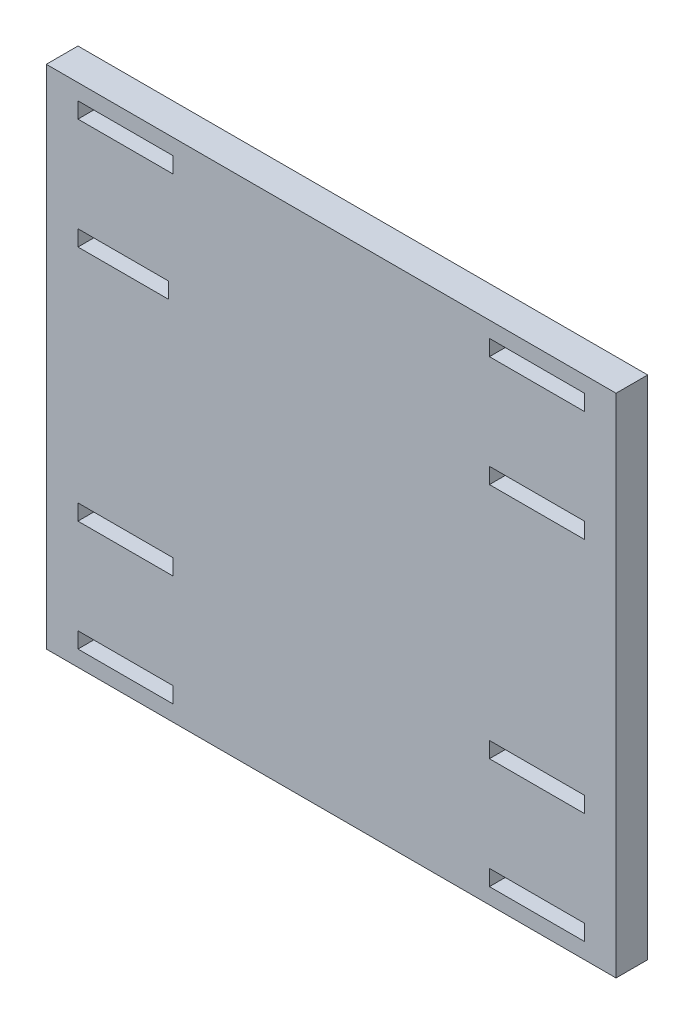
from build123d import *

# Parameters (mm, degrees)
SKETCH1_W           = 180
SKETCH1_H           = 160
BOSS_EXTRUDE1_DEPTH = 10
SKETCH2_W           = 30
SKETCH2_H           = 5
SKETCH2_W_2         = 28.52835194
CUT_EXTRUDE2_DEPTH  = 121.830459736


with BuildPart() as part:
    # Sketch1 → Boss-Extrude1 (new body)
    with BuildSketch(Plane.XY):
        Rectangle(SKETCH1_W, SKETCH1_H)
    extrude(amount=BOSS_EXTRUDE1_DEPTH)

    # Sketch2 → Cut-Extrude2 (cut, through all)
    with BuildSketch(Plane.XY.offset(10)):
        with Locations((-65, 72.5)):
            Rectangle(SKETCH2_W, SKETCH2_H)
        with Locations((65, 72.5)):
            Rectangle(SKETCH2_W, SKETCH2_H)
        with Locations((-65.73582403, 37.5)):
            Rectangle(SKETCH2_W_2, SKETCH2_H)
        with Locations((65, 37.5)):
            Rectangle(SKETCH2_W, SKETCH2_H)
        with Locations((-65, -37.5)):
            Rectangle(SKETCH2_W, SKETCH2_H)
        with Locations((65, -37.5)):
            Rectangle(SKETCH2_W, SKETCH2_H)
        with Locations((-65, -72.5)):
            Rectangle(SKETCH2_W, SKETCH2_H)
        with Locations((65, -72.5)):
            Rectangle(SKETCH2_W, SKETCH2_H)
    extrude(amount=-CUT_EXTRUDE2_DEPTH, mode=Mode.SUBTRACT)


solid = part.part
